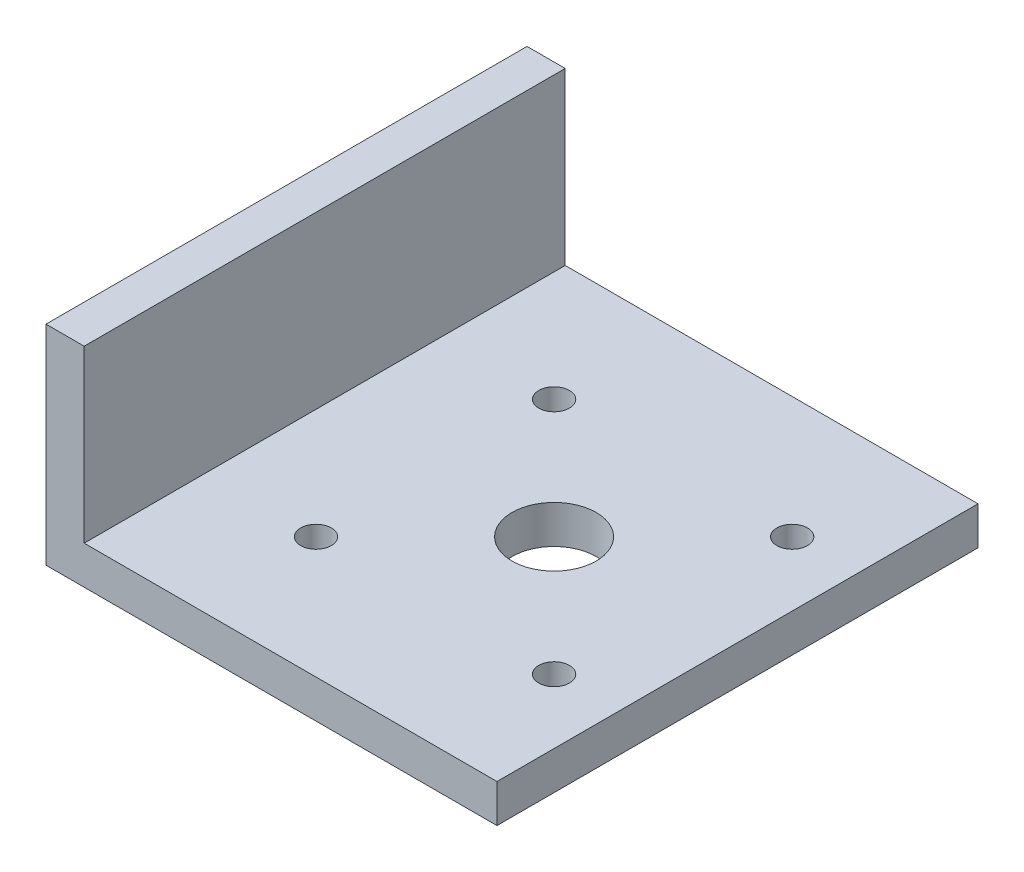
from build123d import *

# Parameters (mm, degrees)
BOSS_EXTRUDE1_DEPTH = 80
SKETCH2_W           = 68.65
SKETCH2_H           = 80
CUT_EXTRUDE1_DEPTH  = 10
SKETCH3_R           = 7
CUT_EXTRUDE2_DEPTH  = 10
SKETCH4_R           = 2.55
CUT_EXTRUDE3_DEPTH  = 10
SKETCH5_W           = 278.618693002
SKETCH5_H           = 61.467749786
CUT_EXTRUDE4_DEPTH  = 10


with BuildPart() as part:
    # Sketch1 → Boss-Extrude1 (new body)
    with BuildSketch(Plane.XY):
        Polygon((0, -37.5), (0, 37.5), (75, 37.5), (75, 31.15), (6.35, 31.15), (6.35, -31.15), (75, -31.15), (75, -37.5), align=None)
    extrude(amount=BOSS_EXTRUDE1_DEPTH)

    # Sketch2 → Cut-Extrude1 (cut)
    with BuildSketch(Plane(origin=(0, 37.5, 0), x_dir=(1, 0, 0), z_dir=(0, 1, 0))):
        with Locations((40.675, -40)):
            Rectangle(SKETCH2_W, SKETCH2_H)
    extrude(amount=-CUT_EXTRUDE1_DEPTH, mode=Mode.SUBTRACT)

    # Sketch3 → Cut-Extrude2 (cut)
    with BuildSketch(Plane.XZ.offset(37.5)):
        with Locations(Location((44.5, 40, 0), (0, 0, 270))):
            Circle(SKETCH3_R)
    extrude(amount=-CUT_EXTRUDE2_DEPTH, mode=Mode.SUBTRACT)

    # Sketch4 → Cut-Extrude3 (cut)
    with BuildSketch(Plane(origin=(0, -31.15, 0), x_dir=(1, 0, 0), z_dir=(0, 1, 0))):
        with Locations(Location((64.298989873, -20.201010127, 0), (0, 0, 270))):
            Circle(SKETCH4_R)
        with Locations(Location((64.298989873, -59.798989873, 0), (0, 0, 270))):
            Circle(SKETCH4_R)
        with Locations(Location((24.701010127, -59.798989873, 0), (0, 0, 270))):
            Circle(SKETCH4_R)
        with Locations(Location((24.701010127, -20.201010127, 0), (0, 0, 270))):
            Circle(SKETCH4_R)
    extrude(amount=-CUT_EXTRUDE3_DEPTH, mode=Mode.SUBTRACT)

    # Sketch5 → Cut-Extrude4 (cut)
    with BuildSketch(Plane(origin=(6.35, 0, 0), x_dir=(0, 0, -1), z_dir=(1, 0, 0))):
        with Locations((-29.250225685, 27.958406515)):
            Rectangle(SKETCH5_W, SKETCH5_H)
    extrude(amount=-CUT_EXTRUDE4_DEPTH, mode=Mode.SUBTRACT)


solid = part.part
